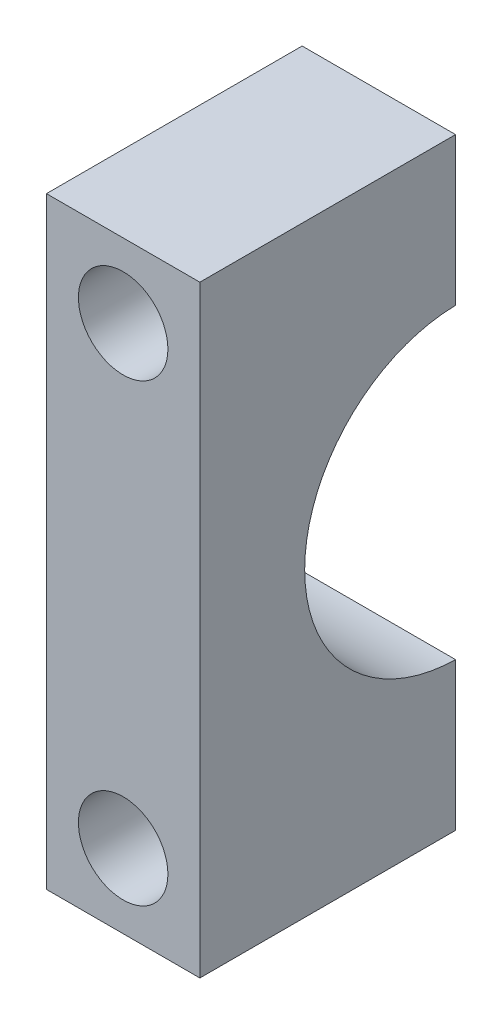
from build123d import *

# Parameters (mm, degrees)
SKICA1_R                 = 1.75
P_IDAT_VYSUNUT_M1_DEPTH  = 10
SKICA2_R                 = 6
ODEBRAT_VYSUNUT_M1_DEPTH = 6


with BuildPart() as part:
    # Skica1 → Přidat vysunutím1 (new body)
    with BuildSketch(Plane.XY):
        Polygon((25.815994553, 2.492123403), (25.815994553, 8.277058671), (19.815994553, 8.277058671), (19.815994553, 2.492123403), (19.815994553, -9.506219408), (19.815994553, -15.291154677), (25.815994553, -15.291154677), (25.815994553, -9.506219408), align=None)
        with Locations((22.815994553, -12.398687042)):
            Circle(SKICA1_R, mode=Mode.SUBTRACT)
        with Locations((22.815994553, 5.384591037)):
            Circle(SKICA1_R, mode=Mode.SUBTRACT)
    extrude(amount=P_IDAT_VYSUNUT_M1_DEPTH)

    # Skica2 → Odebrat vysunutím1 (cut)
    with BuildSketch(Plane.ZY.offset(-19.815994553)):
        with Locations((-0.099711825, -3.507048003)):
            Circle(SKICA2_R)
    extrude(amount=-ODEBRAT_VYSUNUT_M1_DEPTH, mode=Mode.SUBTRACT)


solid = part.part
